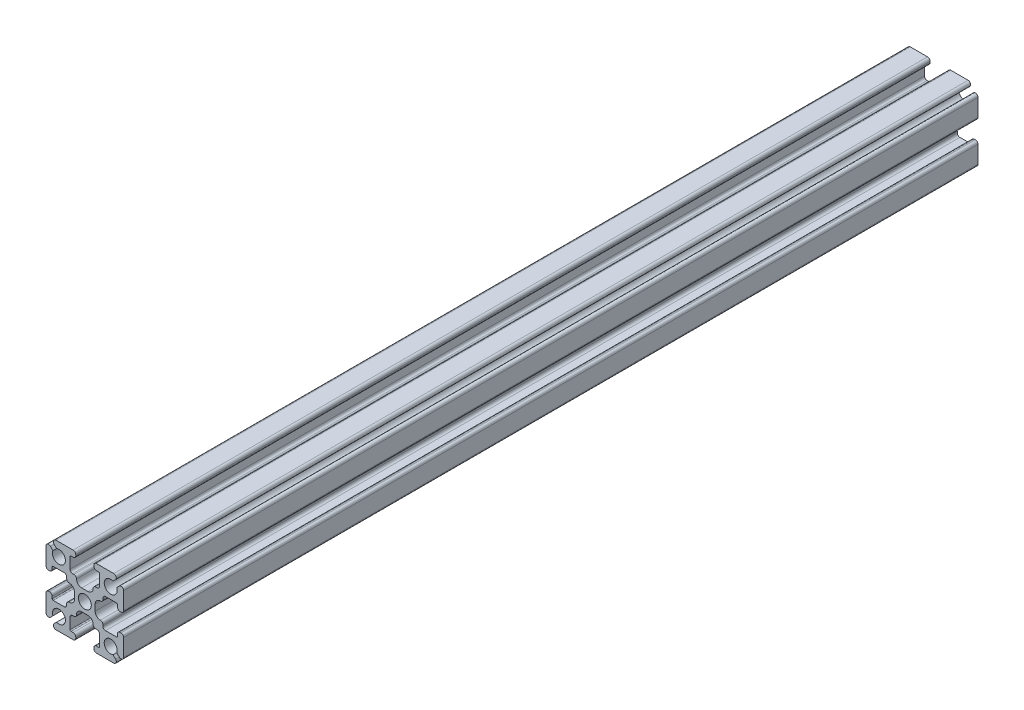
from build123d import *

# Parameters (mm, degrees)
SKETCH1_R           = 1.25
BOSS_EXTRUDE1_DEPTH = 165.1


with BuildPart() as part:
    # Sketch1 → Boss-Extrude1 (new body)
    with BuildSketch(Plane.XY):
        with BuildLine():
            Line((6.646446609, 5.939339828), (6.163645978, 5.456539197))
            ThreePointArc((6.163645978, 5.456539197), (4.116116524, 4.116116524), (5.456539197, 6.163645978))
            Line((5.456539197, 6.163645978), (5.939339828, 6.646446609))
            ThreePointArc((5.939339828, 6.646446609), (6.047726204, 7.191341716), (5.585786438, 7.5))
            Line((5.585786438, 7.5), (2.25, 7.5))
            ThreePointArc((2.25, 7.5), (1.896446609, 7.353553391), (1.75, 7))
            Line((1.75, 7), (1.75, 6.8))
            ThreePointArc((1.75, 6.8), (1.896446609, 6.446446609), (2.25, 6.3))
            Line((2.25, 6.3), (2.65, 6.3))
            ThreePointArc((2.65, 6.3), (2.791421356, 6.241421356), (2.85, 6.1))
            Line((2.85, 6.1), (2.85, 4))
            ThreePointArc((2.85, 4), (2.703553391, 3.646446609), (2.35, 3.5))
            Line((2.35, 3.5), (2.1, 3.5))
            ThreePointArc((2.1, 3.5), (1.746446609, 3.353553391), (1.6, 3))
            ThreePointArc((1.6, 3), (1.307106781, 2.292893219), (0.6, 2))
            Line((0.6, 2), (-0.6, 2))
            ThreePointArc((-0.6, 2), (-1.307106781, 2.292893219), (-1.6, 3))
            ThreePointArc((-1.6, 3), (-1.746446609, 3.353553391), (-2.1, 3.5))
            Line((-2.1, 3.5), (-2.35, 3.5))
            ThreePointArc((-2.35, 3.5), (-2.703553391, 3.646446609), (-2.85, 4))
            Line((-2.85, 4), (-2.85, 6.1))
            ThreePointArc((-2.85, 6.1), (-2.791421356, 6.241421356), (-2.65, 6.3))
            Line((-2.65, 6.3), (-2.25, 6.3))
            ThreePointArc((-2.25, 6.3), (-1.896446609, 6.446446609), (-1.75, 6.8))
            Line((-1.75, 6.8), (-1.75, 7))
            ThreePointArc((-1.75, 7), (-1.896446609, 7.353553391), (-2.25, 7.5))
            Line((-2.25, 7.5), (-5.585786438, 7.5))
            ThreePointArc((-5.585786438, 7.5), (-6.047726204, 7.191341716), (-5.939339828, 6.646446609))
            Line((-5.939339828, 6.646446609), (-5.456539197, 6.163645978))
            ThreePointArc((-5.456539197, 6.163645978), (-4.116116524, 4.116116524), (-6.163645978, 5.456539197))
            Line((-6.163645978, 5.456539197), (-6.646446609, 5.939339828))
            ThreePointArc((-6.646446609, 5.939339828), (-7.191341716, 6.047726204), (-7.5, 5.585786438))
            Line((-7.5, 5.585786438), (-7.5, 2.25))
            ThreePointArc((-7.5, 2.25), (-7.353553391, 1.896446609), (-7, 1.75))
            Line((-7, 1.75), (-6.8, 1.75))
            ThreePointArc((-6.8, 1.75), (-6.446446609, 1.896446609), (-6.3, 2.25))
            Line((-6.3, 2.25), (-6.3, 2.65))
            ThreePointArc((-6.3, 2.65), (-6.241421356, 2.791421356), (-6.1, 2.85))
            Line((-6.1, 2.85), (-4, 2.85))
            ThreePointArc((-4, 2.85), (-3.646446609, 2.703553391), (-3.5, 2.35))
            Line((-3.5, 2.35), (-3.5, 2.1))
            ThreePointArc((-3.5, 2.1), (-3.353553391, 1.746446609), (-3, 1.6))
            ThreePointArc((-3, 1.6), (-2.292893219, 1.307106781), (-2, 0.6))
            Line((-2, 0.6), (-2, -0.6))
            ThreePointArc((-2, -0.6), (-2.292893219, -1.307106781), (-3, -1.6))
            ThreePointArc((-3, -1.6), (-3.353553391, -1.746446609), (-3.5, -2.1))
            Line((-3.5, -2.1), (-3.5, -2.35))
            ThreePointArc((-3.5, -2.35), (-3.646446609, -2.703553391), (-4, -2.85))
            Line((-4, -2.85), (-6.1, -2.85))
            ThreePointArc((-6.1, -2.85), (-6.241421356, -2.791421356), (-6.3, -2.65))
            Line((-6.3, -2.65), (-6.3, -2.25))
            ThreePointArc((-6.3, -2.25), (-6.446446609, -1.896446609), (-6.8, -1.75))
            Line((-6.8, -1.75), (-7, -1.75))
            ThreePointArc((-7, -1.75), (-7.353553391, -1.896446609), (-7.5, -2.25))
            Line((-7.5, -2.25), (-7.5, -5.585786438))
            ThreePointArc((-7.5, -5.585786438), (-7.191341716, -6.047726204), (-6.646446609, -5.939339828))
            Line((-6.646446609, -5.939339828), (-6.163645978, -5.456539197))
            ThreePointArc((-6.163645978, -5.456539197), (-4.116116524, -4.116116524), (-5.456539197, -6.163645978))
            Line((-5.456539197, -6.163645978), (-5.939339828, -6.646446609))
            ThreePointArc((-5.939339828, -6.646446609), (-6.047726204, -7.191341716), (-5.585786438, -7.5))
            Line((-5.585786438, -7.5), (-2.25, -7.5))
            ThreePointArc((-2.25, -7.5), (-1.896446609, -7.353553391), (-1.75, -7))
            Line((-1.75, -7), (-1.75, -6.8))
            ThreePointArc((-1.75, -6.8), (-1.896446609, -6.446446609), (-2.25, -6.3))
            Line((-2.25, -6.3), (-2.65, -6.3))
            ThreePointArc((-2.65, -6.3), (-2.791421356, -6.241421356), (-2.85, -6.1))
            Line((-2.85, -6.1), (-2.85, -4))
            ThreePointArc((-2.85, -4), (-2.703553391, -3.646446609), (-2.35, -3.5))
            Line((-2.35, -3.5), (-2.1, -3.5))
            ThreePointArc((-2.1, -3.5), (-1.746446609, -3.353553391), (-1.6, -3))
            ThreePointArc((-1.6, -3), (-1.307106781, -2.292893219), (-0.6, -2))
            Line((-0.6, -2), (0.6, -2))
            ThreePointArc((0.6, -2), (1.307106781, -2.292893219), (1.6, -3))
            ThreePointArc((1.6, -3), (1.746446609, -3.353553391), (2.1, -3.5))
            Line((2.1, -3.5), (2.35, -3.5))
            ThreePointArc((2.35, -3.5), (2.703553391, -3.646446609), (2.85, -4))
            Line((2.85, -4), (2.85, -6.1))
            ThreePointArc((2.85, -6.1), (2.791421356, -6.241421356), (2.65, -6.3))
            Line((2.65, -6.3), (2.25, -6.3))
            ThreePointArc((2.25, -6.3), (1.896446609, -6.446446609), (1.75, -6.8))
            Line((1.75, -6.8), (1.75, -7))
            ThreePointArc((1.75, -7), (1.896446609, -7.353553391), (2.25, -7.5))
            Line((2.25, -7.5), (5.585786438, -7.5))
            ThreePointArc((5.585786438, -7.5), (6.047726204, -7.191341716), (5.939339828, -6.646446609))
            Line((5.939339828, -6.646446609), (5.456539197, -6.163645978))
            ThreePointArc((5.456539197, -6.163645978), (4.116116524, -4.116116524), (6.163645978, -5.456539197))
            Line((6.163645978, -5.456539197), (6.646446609, -5.939339828))
            ThreePointArc((6.646446609, -5.939339828), (7.191341716, -6.047726204), (7.5, -5.585786438))
            Line((7.5, -5.585786438), (7.5, -2.25))
            ThreePointArc((7.5, -2.25), (7.353553391, -1.896446609), (7, -1.75))
            Line((7, -1.75), (6.8, -1.75))
            ThreePointArc((6.8, -1.75), (6.446446609, -1.896446609), (6.3, -2.25))
            Line((6.3, -2.25), (6.3, -2.65))
            ThreePointArc((6.3, -2.65), (6.241421356, -2.791421356), (6.1, -2.85))
            Line((6.1, -2.85), (4, -2.85))
            ThreePointArc((4, -2.85), (3.646446609, -2.703553391), (3.5, -2.35))
            Line((3.5, -2.35), (3.5, -2.1))
            ThreePointArc((3.5, -2.1), (3.353553391, -1.746446609), (3, -1.6))
            ThreePointArc((3, -1.6), (2.292893219, -1.307106781), (2, -0.6))
            Line((2, -0.6), (2, 0.6))
            ThreePointArc((2, 0.6), (2.292893219, 1.307106781), (3, 1.6))
            ThreePointArc((3, 1.6), (3.353553391, 1.746446609), (3.5, 2.1))
            Line((3.5, 2.1), (3.5, 2.35))
            ThreePointArc((3.5, 2.35), (3.646446609, 2.703553391), (4, 2.85))
            Line((4, 2.85), (6.1, 2.85))
            ThreePointArc((6.1, 2.85), (6.241421356, 2.791421356), (6.3, 2.65))
            Line((6.3, 2.65), (6.3, 2.25))
            ThreePointArc((6.3, 2.25), (6.446446609, 1.896446609), (6.8, 1.75))
            Line((6.8, 1.75), (7, 1.75))
            ThreePointArc((7, 1.75), (7.353553391, 1.896446609), (7.5, 2.25))
            Line((7.5, 2.25), (7.5, 5.585786438))
            ThreePointArc((7.5, 5.585786438), (7.191341716, 6.047726204), (6.646446609, 5.939339828))
        make_face()
        with Locations(Location((0, 0, 0), (0, 0, 180))):
            Circle(SKETCH1_R, mode=Mode.SUBTRACT)
    extrude(amount=BOSS_EXTRUDE1_DEPTH)


solid = part.part
